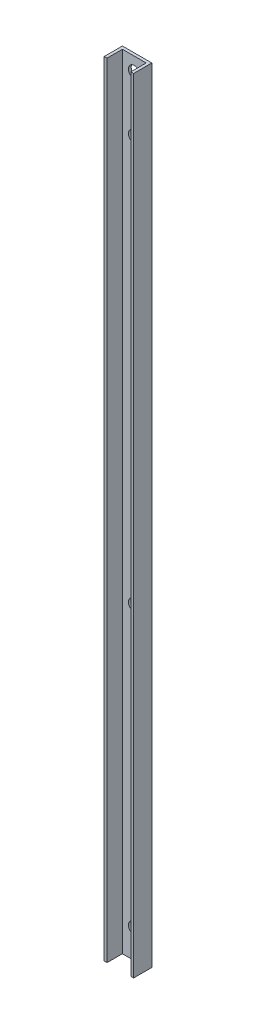
from build123d import *

# Parameters (mm, degrees)
EXTRUDE_THIN1_DEPTH = 280
SKETCH2_R           = 2.1
CUT_EXTRUDE1_DEPTH  = 10


with BuildPart() as part:
    # Sketch1 → Extrude-Thin1 (new body)
    with BuildSketch(Plane(origin=(0, 0, 0), x_dir=(1, 0, 0), z_dir=(0, 1, 0))):
        Polygon((-3.469957082, -1.813304721), (-3.469957082, 4.686695279), (7.030042918, 4.686695279), (7.030042918, -1.813304721), (6.030042918, -1.813304721), (6.030042918, 3.686695279), (-2.469957082, 3.686695279), (-2.469957082, -1.813304721), align=None)
    extrude(amount=EXTRUDE_THIN1_DEPTH)

    # Sketch2 → Cut-Extrude1 (cut)
    with BuildSketch(Plane(origin=(0, 0, -4.686695279), x_dir=(-1, 0, 0), z_dir=(0, 0, -1))):
        with Locations((-1.780042918, 275)):
            Circle(SKETCH2_R)
        with Locations((-1.780042918, 255)):
            Circle(SKETCH2_R)
        with Locations((-1.780042918, 110)):
            Circle(SKETCH2_R)
        with Locations((-1.780042918, 10)):
            Circle(SKETCH2_R)
    extrude(amount=-CUT_EXTRUDE1_DEPTH, mode=Mode.SUBTRACT)


solid = part.part
